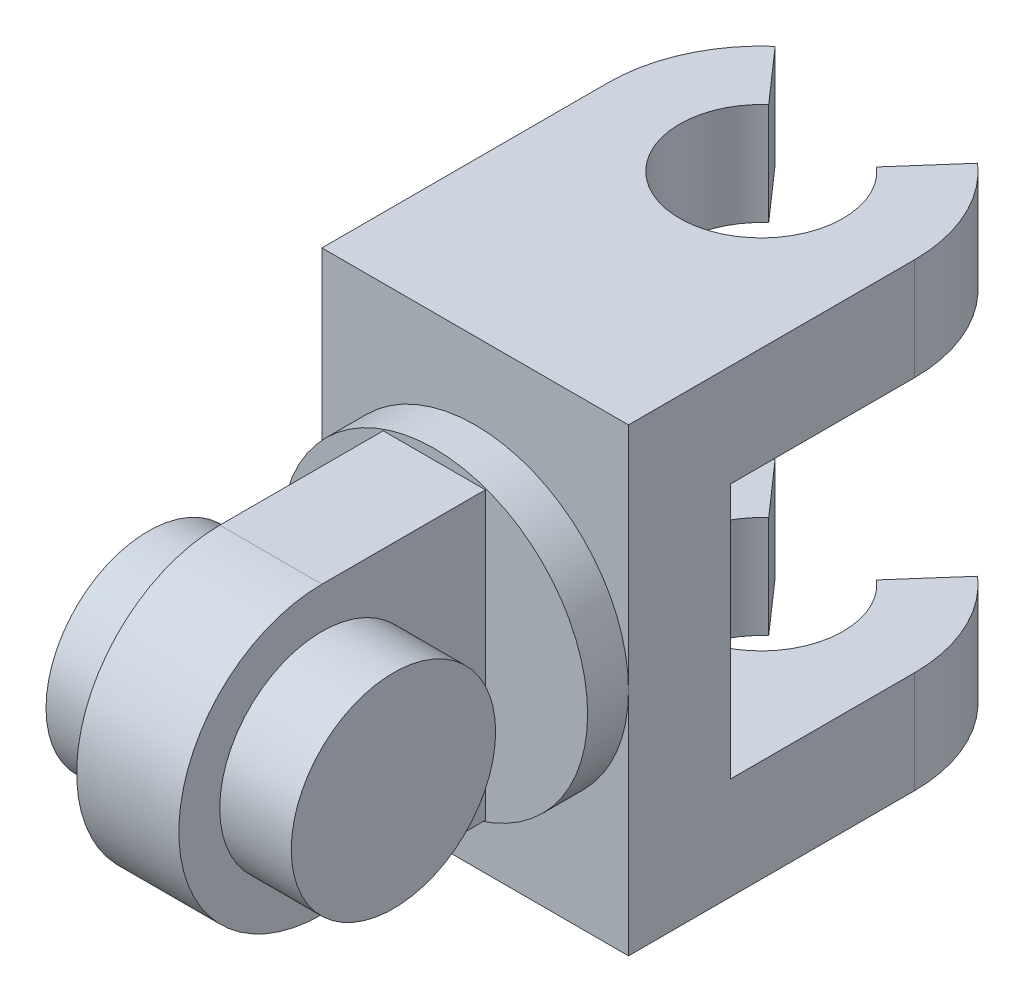
from build123d import *

# Parameters (mm, degrees)
SKETCH3_R           = 10
BOSS_EXTRUDE2_DEPTH = 12
BOSS_EXTRUDE3_DEPTH = 5
SKETCH5_R           = 15
BOSS_EXTRUDE4_DEPTH = 4
SKETCH6_W           = 30
SKETCH6_H           = 45
BOSS_EXTRUDE6_DEPTH = 10
BOSS_EXTRUDE7_START = 12.5
SKETCH7_R           = 8
BOSS_EXTRUDE7_DEPTH = 10
BOSS_EXTRUDE8_START = -22.5
SKETCH7_2_R         = 8
BOSS_EXTRUDE8_DEPTH = 10
CUT_EXTRUDE1_REACH  = 80.861


with BuildPart() as part:
    # Sketch3 → Boss-Extrude2 (new, symmetric)
    with BuildSketch(Plane(origin=(0, 0, 0), x_dir=(0, 0, -1), z_dir=(1, 0, 0))):
        Circle(SKETCH3_R)
    extrude(amount=BOSS_EXTRUDE2_DEPTH, both=True)

    # Sketch4 → Boss-Extrude3 (add, symmetric)
    with BuildSketch(Plane(origin=(0, 0, 0), x_dir=(0, 0, -1), z_dir=(1, 0, 0))):
        with BuildLine():
            Line((0, 14), (16, 14))
            Line((16, 14), (16, -14))
            Line((16, -14), (0, -14))
            ThreePointArc((0, -14), (-14, 0), (0, 14))
        make_face()
    extrude(amount=BOSS_EXTRUDE3_DEPTH, both=True)

    # Sketch5 → Boss-Extrude4 (add)
    with BuildSketch(Plane(origin=(0, 0, -16), x_dir=(-1, 0, 0), z_dir=(0, 0, -1))):
        Circle(SKETCH5_R)
    extrude(amount=BOSS_EXTRUDE4_DEPTH)

    # Sketch6 → Boss-Extrude6 (add)
    with BuildSketch(Plane(origin=(0, 0, -20), x_dir=(-1, 0, 0), z_dir=(0, 0, -1))):
        Rectangle(SKETCH6_W, SKETCH6_H)
    extrude(amount=BOSS_EXTRUDE6_DEPTH)

    # Sketch7 → Boss-Extrude7 (add)
    with BuildSketch(Plane(origin=(0, 0, 0), x_dir=(1, 0, 0), z_dir=(0, 1, 0)).offset(BOSS_EXTRUDE7_START)):
        with BuildLine():
            Line((-15, 30), (-15, 48))
            ThreePointArc((-15, 48), (0, 63), (15, 48))
            Line((15, 48), (15, 30))
            Line((15, 30), (-15, 30))
        make_face()
        with Locations(Location((0, 48, 0), (0, 0, 270))):
            Circle(SKETCH7_R, mode=Mode.SUBTRACT)
    extrude(amount=BOSS_EXTRUDE7_DEPTH)

    # Sketch7<2> → Boss-Extrude8 (add)
    with BuildSketch(Plane(origin=(0, 0, 0), x_dir=(1, 0, 0), z_dir=(0, 1, 0)).offset(BOSS_EXTRUDE8_START)):
        with BuildLine():
            Line((-15, 30), (-15, 48))
            ThreePointArc((-15, 48), (0, 63), (15, 48))
            Line((15, 48), (15, 30))
            Line((15, 30), (-15, 30))
        make_face()
        with Locations(Location((0, 48, 0), (0, 0, 270))):
            Circle(SKETCH7_2_R, mode=Mode.SUBTRACT)
    extrude(amount=BOSS_EXTRUDE8_DEPTH)

    # Cut-Extrude1: up to this face of the body (flat: up to its plane)
    cut_extrude1_end = Plane(part.part.faces().sort_by_distance((0, -22.5, -38.416854183))[0])
    # Sketch8 → Cut-Extrude1 (cut, up to the picked face)
    with BuildSketch(Plane(origin=(0, 22.5, 0), x_dir=(1, 0, 0), z_dir=(0, 1, 0)), mode=Mode.PRIVATE) as cut_extrude1_sk1:
        with BuildLine():
            Line((-9.909192751, 59.260901342), (-5.2849028, 54.005814049))
            ThreePointArc((-5.2849028, 54.005814049), (0, 56), (5.2849028, 54.005814049))
            Line((5.2849028, 54.005814049), (9.909192751, 59.260901342))
            ThreePointArc((9.909192751, 59.260901342), (0, 63), (-9.909192751, 59.260901342))
        make_face()
    cut_extrude1_tool1 = split(extrude(cut_extrude1_sk1.sketch, amount=-CUT_EXTRUDE1_REACH, mode=Mode.PRIVATE), bisect_by=cut_extrude1_end, keep=Keep.BOTH, mode=Mode.PRIVATE)
    add(cut_extrude1_tool1.solids().sort_by(Axis((0, 22.5, -58.852599), (0, -1, 0)))[0], mode=Mode.SUBTRACT)


solid = part.part
